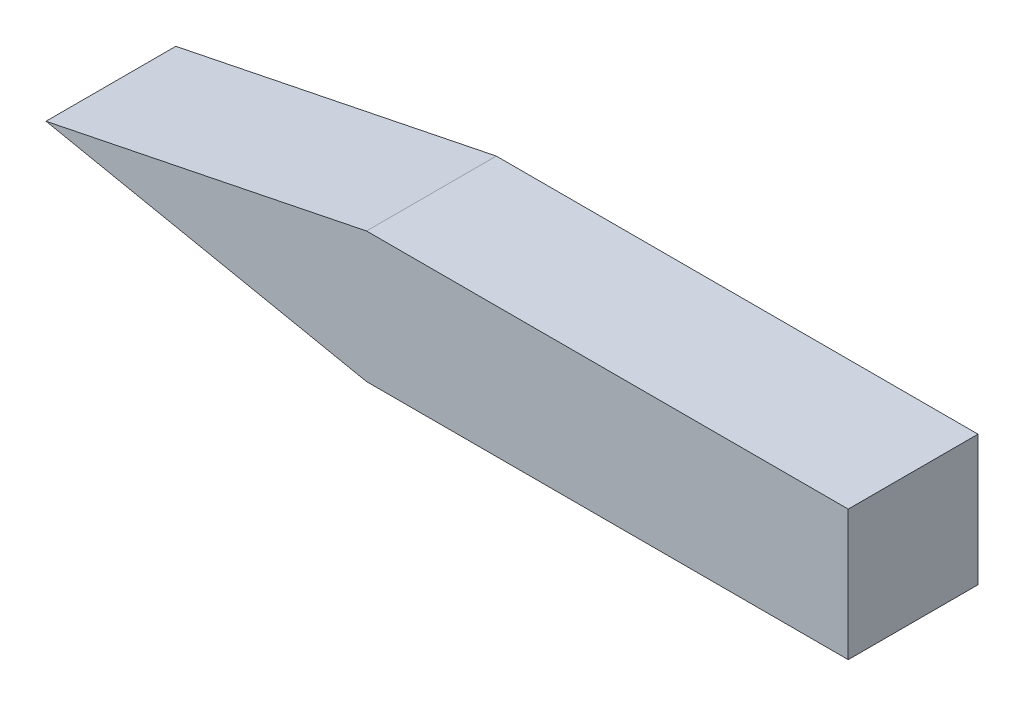
from build123d import *

# Parameters (mm, degrees)
EXTRUDE_1_DEPTH = 6


with BuildPart() as part:
    # 草圖1 → 填料-伸長1 (new body)
    with BuildSketch(Plane.XY):
        Polygon((0, 0), (14.82, 3.015163077), (37.09, 3.015163077), (37.09, -3.015163077), (14.82, -3.015163077), align=None)
    extrude(amount=EXTRUDE_1_DEPTH)


solid = part.part
